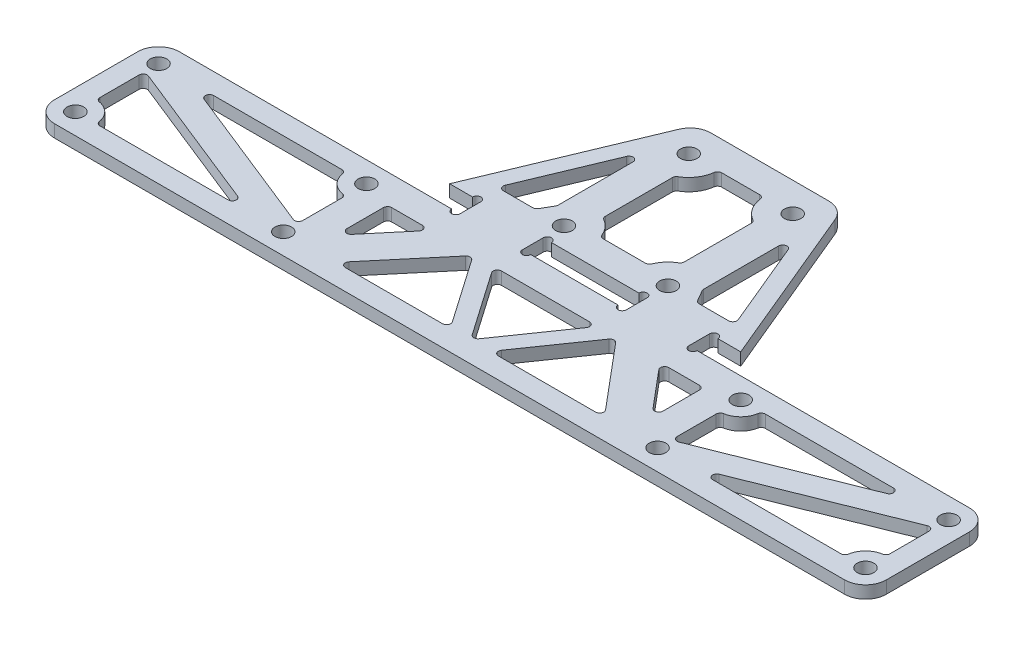
from build123d import *

# Parameters (mm, degrees)
SKETCH_1_R          = 2
EXTRUDE_1_DEPTH     = 3
FILLET_1_R          = 5
CUT_EXTRUDE_1_DEPTH = 120.437222004


with BuildPart() as part:
    # 草图1 → 凸台-拉伸1 (new body)
    with BuildSketch(Plane(origin=(0, 0, 0), x_dir=(1, 0, 0), z_dir=(0, 1, 0))):
        with BuildLine():
            Line((-5, 37), (30, 37))
            Line((30, 37), (47.5, -5))
            Line((47.5, -5), (42, -5))
            ThreePointArc((42, -5), (41, -4), (40, -5))
            Line((40, -5), (40, -10))
            ThreePointArc((40, -10), (41, -11), (42, -10))
            Line((42, -10), (112.5, -10))
            Line((112.5, -10), (112.5, -40))
            Line((112.5, -40), (-87.5, -40))
            Line((-87.5, -40), (-87.5, -10))
            Line((-87.5, -10), (-17, -10))
            ThreePointArc((-17, -10), (-16, -11), (-15, -10))
            Line((-15, -10), (-15, -5))
            ThreePointArc((-15, -5), (-16, -4), (-17, -5))
            Line((-17, -5), (-22.5, -5))
            Line((-22.5, -5), (-5, 37))
        make_face()
        with Locations(Location((0, 30, 0), (0, 0, 270))):
            Circle(SKETCH_1_R, mode=Mode.SUBTRACT)
        with Locations(Location((0, 0, 0), (0, 0, 270))):
            Circle(SKETCH_1_R, mode=Mode.SUBTRACT)
        with Locations(Location((-82.5, -15, 0), (0, 0, 270))):
            Circle(SKETCH_1_R, mode=Mode.SUBTRACT)
        with Locations(Location((-32.5, -15, 0), (0, 0, 270))):
            Circle(SKETCH_1_R, mode=Mode.SUBTRACT)
        with Locations(Location((-82.5, -35, 0), (0, 0, 270))):
            Circle(SKETCH_1_R, mode=Mode.SUBTRACT)
        with Locations(Location((-32.5, -35, 0), (0, 0, 270))):
            Circle(SKETCH_1_R, mode=Mode.SUBTRACT)
        with Locations(Location((57.5, -35, 0), (0, 0, 90))):
            Circle(SKETCH_1_R, mode=Mode.SUBTRACT)
        with Locations(Location((107.5, -35, 0), (0, 0, 90))):
            Circle(SKETCH_1_R, mode=Mode.SUBTRACT)
        with Locations(Location((57.5, -15, 0), (0, 0, 90))):
            Circle(SKETCH_1_R, mode=Mode.SUBTRACT)
        with Locations(Location((107.5, -15, 0), (0, 0, 90))):
            Circle(SKETCH_1_R, mode=Mode.SUBTRACT)
        with Locations(Location((25, 0, 0), (0, 0, 90))):
            Circle(SKETCH_1_R, mode=Mode.SUBTRACT)
        with Locations(Location((25, 30, 0), (0, 0, 90))):
            Circle(SKETCH_1_R, mode=Mode.SUBTRACT)
        with BuildLine():
            Line((2, -10), (23, -10))
            ThreePointArc((23, -10), (24, -11), (25, -10))
            Line((25, -10), (25, -5))
            ThreePointArc((25, -5), (24, -4), (23, -5))
            Line((23, -5), (2, -5))
            ThreePointArc((2, -5), (1, -4), (0, -5))
            Line((0, -5), (0, -10))
            ThreePointArc((0, -10), (1, -11), (2, -10))
        make_face(mode=Mode.SUBTRACT)
    extrude(amount=EXTRUDE_1_DEPTH)

    # 圆角1
    fillet_1_edges = [part.edges().sort_by_distance(p)[0] for p in [
        (-5, 1.5, -37),
        (30, 1.5, -37),
        (112.5, 1.5, 10),
        (112.5, 1.5, 40),
        (-87.5, 1.5, 40),
        (-87.5, 1.5, 10),
    ]]
    fillet(fillet_1_edges, radius=FILLET_1_R)

    # 草图2 → 切除-拉伸1 (cut, through all)
    with BuildSketch(Plane(origin=(0, 3, 0), x_dir=(1, 0, 0), z_dir=(0, 1, 0))):
        with BuildLine():
            Line((-82.5, -29.083920217), (-82.5, -19.708131846))
            ThreePointArc((-82.5, -19.708131846), (-82.060628809, -18.880064615), (-81.128609324, -18.779655155))
            Line((-81.128609324, -18.779655155), (-45.398938938, -33.071523309))
            ThreePointArc((-45.398938938, -33.071523309), (-44.788373228, -34.189107521), (-45.770329614, -35))
            Line((-45.770329614, -35), (-76.583920217, -35))
            ThreePointArc((-76.583920217, -35), (-77.229417441, -34.763762616), (-77.569933514, -34.166666667))
            ThreePointArc((-77.569933514, -34.166666667), (-78.964466094, -31.464466094), (-81.666666667, -30.069933514))
            ThreePointArc((-81.666666667, -30.069933514), (-82.263762616, -29.729417441), (-82.5, -29.083920217))
        make_face()
        with BuildLine():
            Line((-38.416079783, -15), (-69.229670386, -15))
            ThreePointArc((-69.229670386, -15), (-70.211626772, -15.810892479), (-69.601061062, -16.928476691))
            Line((-69.601061062, -16.928476691), (-33.871390676, -31.220344845))
            ThreePointArc((-33.871390676, -31.220344845), (-32.939371191, -31.119935385), (-32.5, -30.291868154))
            Line((-32.5, -30.291868154), (-32.5, -20.916079783))
            ThreePointArc((-32.5, -20.916079783), (-32.736237384, -20.270582559), (-33.333333333, -19.930066486))
            ThreePointArc((-33.333333333, -19.930066486), (-36.035533906, -18.535533906), (-37.430066486, -15.833333333))
            ThreePointArc((-37.430066486, -15.833333333), (-37.770582559, -15.236237384), (-38.416079783, -15))
        make_face()
        with BuildLine():
            Line((57.5, -30.291868154), (57.5, -20.916079783))
            ThreePointArc((57.5, -20.916079783), (57.736237384, -20.270582559), (58.333333333, -19.930066486))
            ThreePointArc((58.333333333, -19.930066486), (61.035533906, -18.535533906), (62.430066486, -15.833333333))
            ThreePointArc((62.430066486, -15.833333333), (62.770582559, -15.236237384), (63.416079783, -15))
            Line((63.416079783, -15), (94.229670386, -15))
            ThreePointArc((94.229670386, -15), (95.211626772, -15.810892479), (94.601061062, -16.928476691))
            Line((94.601061062, -16.928476691), (58.871390676, -31.220344845))
            ThreePointArc((58.871390676, -31.220344845), (57.939371191, -31.119935385), (57.5, -30.291868154))
        make_face()
        with BuildLine():
            Line((70.770329614, -35), (101.583920217, -35))
            ThreePointArc((101.583920217, -35), (102.229417441, -34.763762616), (102.569933514, -34.166666667))
            ThreePointArc((102.569933514, -34.166666667), (103.964466094, -31.464466094), (106.666666667, -30.069933514))
            ThreePointArc((106.666666667, -30.069933514), (107.263762616, -29.729417441), (107.5, -29.083920217))
            Line((107.5, -29.083920217), (107.5, -19.708131846))
            ThreePointArc((107.5, -19.708131846), (107.060628809, -18.880064615), (106.128609324, -18.779655155))
            Line((106.128609324, -18.779655155), (70.398938938, -33.071523309))
            ThreePointArc((70.398938938, -33.071523309), (69.788373228, -34.189107521), (70.770329614, -35))
        make_face()
        with BuildLine():
            Line((-14.583333333, 0), (-7.505553499, 0))
            ThreePointArc((-7.505553499, 0), (-7.005553499, 0.133974596), (-6.639528096, 0.5))
            Line((-6.639528096, 0.5), (-5.133974596, 3.107695155))
            ThreePointArc((-5.133974596, 3.107695155), (-5.034074174, 3.348876109), (-5, 3.607695155))
            Line((-5, 3.607695155), (-5, 21.6))
            ThreePointArc((-5, 21.6), (-5.803883865, 22.580580676), (-6.923076923, 21.984615385))
            Line((-6.923076923, 21.984615385), (-15.506410256, 1.384615385))
            ThreePointArc((-15.506410256, 1.384615385), (-15.415383628, 0.445299804), (-14.583333333, 0))
        make_face()
        with BuildLine():
            Line((30, 3.607695155), (30, 21.6))
            ThreePointArc((30, 21.6), (30.803883865, 22.580580676), (31.923076923, 21.984615385))
            Line((31.923076923, 21.984615385), (40.506410256, 1.384615385))
            ThreePointArc((40.506410256, 1.384615385), (40.415383628, 0.445299804), (39.583333333, 0))
            Line((39.583333333, 0), (32.505553499, 0))
            ThreePointArc((32.505553499, 0), (32.005553499, 0.133974596), (31.639528096, 0.5))
            Line((31.639528096, 0.5), (30.133974596, 3.107695155))
            ThreePointArc((30.133974596, 3.107695155), (30.034074174, 3.348876109), (30, 3.607695155))
        make_face()
        with BuildLine():
            Line((3, 23.07179677), (3, 6.92820323))
            ThreePointArc((3, 6.92820323), (3.133974596, 6.42820323), (3.5, 6.062177826))
            ThreePointArc((3.5, 6.062177826), (5.281992573, 4.593533984), (6.489173676, 2.625))
            ThreePointArc((6.489173676, 2.625), (6.857181493, 2.170843802), (7.416198487, 2))
            Line((7.416198487, 2), (17.583801513, 2))
            ThreePointArc((17.583801513, 2), (18.142818507, 2.170843802), (18.510826324, 2.625))
            ThreePointArc((18.510826324, 2.625), (19.718007427, 4.593533984), (21.5, 6.062177826))
            ThreePointArc((21.5, 6.062177826), (21.866025404, 6.42820323), (22, 6.92820323))
            Line((22, 6.92820323), (22, 23.07179677))
            ThreePointArc((22, 23.07179677), (21.866025404, 23.57179677), (21.5, 23.937822174))
            ThreePointArc((21.5, 23.937822174), (19.168900851, 26.127238361), (18.054902808, 29.125))
            ThreePointArc((18.054902808, 29.125), (17.724183895, 29.75), (17.062746067, 30))
            Line((17.062746067, 30), (7.937253933, 30))
            ThreePointArc((7.937253933, 30), (7.275816105, 29.75), (6.945097192, 29.125))
            ThreePointArc((6.945097192, 29.125), (5.831099149, 26.127238361), (3.5, 23.937822174))
            ThreePointArc((3.5, 23.937822174), (3.133974596, 23.57179677), (3, 23.07179677))
        make_face()
        with BuildLine():
            Line((1.911922611, -16.928476691), (23.088077389, -16.928476691))
            ThreePointArc((23.088077389, -16.928476691), (23.974191323, -17.465009221), (23.909447355, -18.4988725))
            Line((23.909447355, -18.4988725), (13.321369966, -33.74570394))
            ThreePointArc((13.321369966, -33.74570394), (12.5, -34.175308131), (11.678630034, -33.74570394))
            Line((11.678630034, -33.74570394), (1.090552645, -18.4988725))
            ThreePointArc((1.090552645, -18.4988725), (1.025808677, -17.465009221), (1.911922611, -16.928476691))
        make_face()
        with BuildLine():
            Line((-25.5, -17.928476691), (-25.5, -26.683255004))
            ThreePointArc((-25.5, -26.683255004), (-24.842268268, -27.622857277), (-23.734295135, -27.32644709))
            Line((-23.734295135, -27.32644709), (-16.380281353, -18.571668777))
            ThreePointArc((-16.380281353, -18.571668777), (-16.239566865, -17.506097765), (-17.145986217, -16.928476691))
            Line((-17.145986217, -16.928476691), (-24.5, -16.928476691))
            ThreePointArc((-24.5, -16.928476691), (-25.207106781, -17.22136991), (-25.5, -17.928476691))
        make_face()
        with BuildLine():
            Line((-18.351908488, -33.356807914), (-5.56722188, -18.136942904))
            ThreePointArc((-5.56722188, -18.136942904), (-4.755696983, -17.781185279), (-3.980147049, -18.20973918))
            Line((-3.980147049, -18.20973918), (6.589203652, -33.429604191))
            ThreePointArc((6.589203652, -33.429604191), (6.653947621, -34.463467469), (5.767833687, -35))
            Line((5.767833687, -35), (-17.586203623, -35))
            ThreePointArc((-17.586203623, -35), (-18.492622976, -34.422378926), (-18.351908488, -33.356807914))
        make_face()
        with BuildLine():
            Line((28.980147049, -18.20973918), (18.410796348, -33.429604191))
            ThreePointArc((18.410796348, -33.429604191), (18.346052379, -34.463467469), (19.232166313, -35))
            Line((19.232166313, -35), (42.586203623, -35))
            ThreePointArc((42.586203623, -35), (43.492622976, -34.422378926), (43.351908488, -33.356807914))
            Line((43.351908488, -33.356807914), (30.56722188, -18.136942904))
            ThreePointArc((30.56722188, -18.136942904), (29.755696983, -17.781185279), (28.980147049, -18.20973918))
        make_face()
        with BuildLine():
            Line((48.734295135, -27.32644709), (41.380281353, -18.571668777))
            ThreePointArc((41.380281353, -18.571668777), (41.239566865, -17.506097765), (42.145986217, -16.928476691))
            Line((42.145986217, -16.928476691), (49.5, -16.928476691))
            ThreePointArc((49.5, -16.928476691), (50.207106781, -17.22136991), (50.5, -17.928476691))
            Line((50.5, -17.928476691), (50.5, -26.683255004))
            ThreePointArc((50.5, -26.683255004), (49.842268268, -27.622857277), (48.734295135, -27.32644709))
        make_face()
    extrude(amount=-CUT_EXTRUDE_1_DEPTH, mode=Mode.SUBTRACT)


solid = part.part
